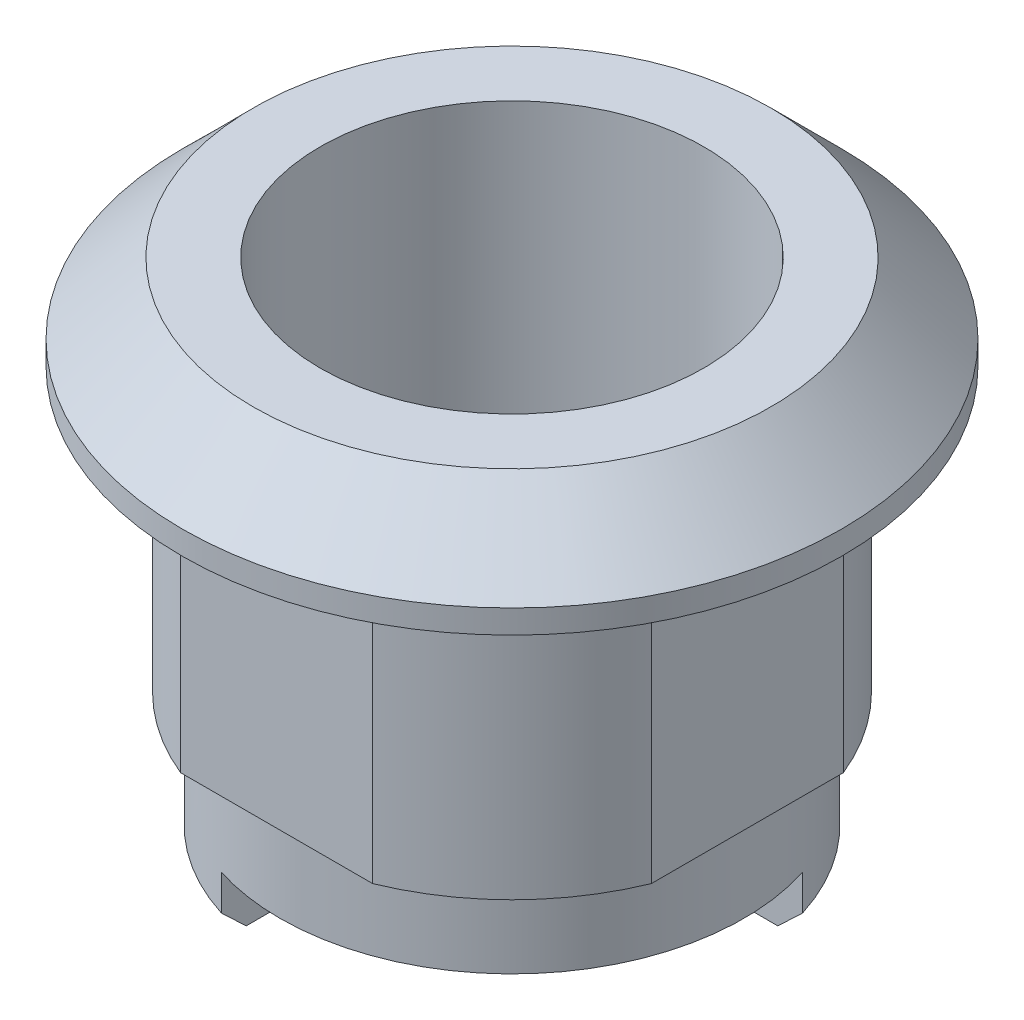
from build123d import *

# Parameters (mm, degrees)
SMUSSO1_SIZE             = 3
SCHIZZO2_R               = 18.679375542
SCHIZZO2_W               = 20
SCHIZZO2_H               = 20
TAGLIO_ESTRUSIONE1_DEPTH = 17.9
SCHIZZO3_W               = 20
SCHIZZO3_H               = 20
TAGLIO_ESTRUSIONE2_DEPTH = 2.5
SMUSSO2_SIZE             = 1


with BuildPart() as part:
    # Schizzo1 → Rivoluzione1 (revolve)
    with BuildSketch(Plane.XY, mode=Mode.PRIVATE) as rivoluzione1_sk:
        Polygon((8.15, -4.65), (8.15, 10.95), (14, 10.95), (14, 6.95), (10.8, 6.95), (10.8, -5.05), (9.85, -5.05), (9.85, -10.95), (5.1, -10.95), (5.1, -4.65), align=None)
    revolve(rivoluzione1_sk.sketch.rotate(Axis((0, 15.297202797, 0), (0, -1, 0)), 90), axis=Axis((0, 15.297202797, 0), (0, -1, 0)))

    # Smusso1
    smusso1_edges = [part.edges().sort_by_distance(p)[0] for p in [
        (0, 10.95, -14),
    ]]
    chamfer(smusso1_edges, length=SMUSSO1_SIZE)

    # Schizzo2 → Taglio-Estrusione1 (cut)
    with BuildSketch(Plane.XZ.offset(10.95)):
        Circle(SCHIZZO2_R)
        Rectangle(SCHIZZO2_W, SCHIZZO2_H, mode=Mode.SUBTRACT)
    extrude(amount=-TAGLIO_ESTRUSIONE1_DEPTH, mode=Mode.SUBTRACT)

    # Schizzo3 → Taglio-Estrusione2 (cut)
    with BuildSketch(Plane.XZ.offset(10.95)):
        with Locations((7.05, 7.05)):
            Rectangle(SCHIZZO3_W, SCHIZZO3_H)
    extrude(amount=-TAGLIO_ESTRUSIONE2_DEPTH, mode=Mode.SUBTRACT)

    # Smusso2
    smusso2_edges = [part.edges().sort_by_distance(p)[0] for p in [
        (-6.965001795, -10.95, -6.965001795),
    ]]
    chamfer(smusso2_edges, length=SMUSSO2_SIZE)


solid = part.part
